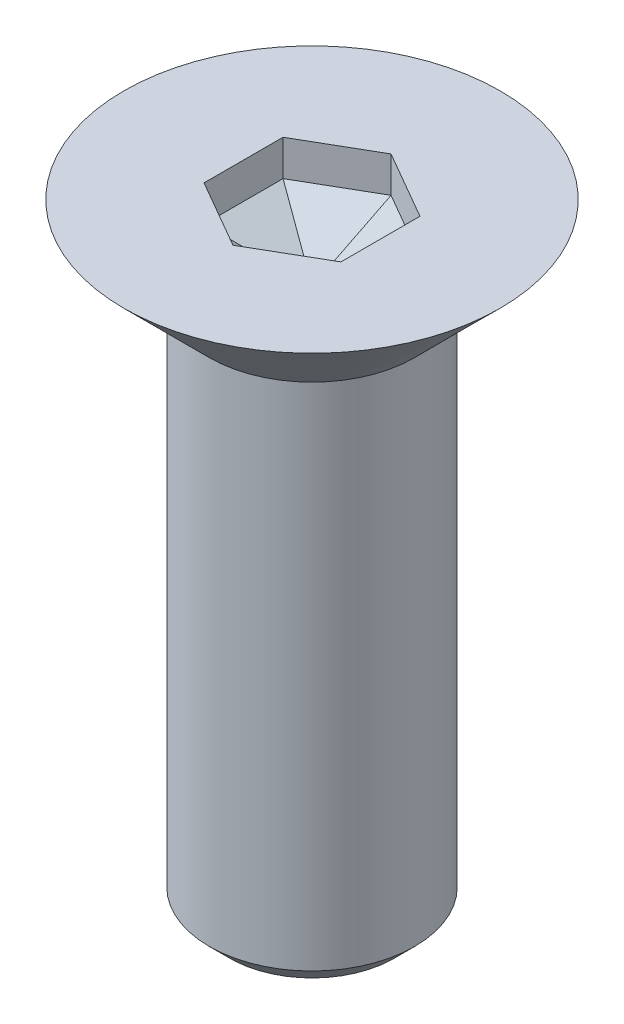
from build123d import *
from OCP.BRepFilletAPI import BRepFilletAPI_MakeChamfer

# Parameters (mm, degrees)
SKETCH_4_R          = 1.5
EXTRUDE_2_DEPTH     = 9
CUT_EXTRUDE_1_DEPTH = 1.1
CHAMFER_3_SIZE      = 0.576368876
CHAMFER_3_SIZE2     = 0.998300177
CHAMFER_4_SIZE      = 0.3


with BuildPart() as part:
    # 草图2 → 旋转1 (revolve)
    with BuildSketch(Plane.XY):
        Polygon((0, -1.86), (0, 0), (2.75, 0), (0.89, -1.86), align=None)
    revolve(axis=Axis((0, -1.86, 0), (0, 1, 0)))

    # 草图4 → 凸台-拉伸2 (add)
    with BuildSketch(Plane.XZ):
        Circle(SKETCH_4_R)
    extrude(amount=EXTRUDE_2_DEPTH)

    # 草图3 → 切除-拉伸1 (cut)
    with BuildSketch(Plane(origin=(0, 0, 0), x_dir=(1, 0, 0), z_dir=(0, 1, 0))):
        Polygon((1, 0.577350269), (0, 1.154700538), (-1, 0.577350269), (-1, -0.577350269), (0, -1.154700538), (1, -0.577350269), align=None)
    extrude(amount=-CUT_EXTRUDE_1_DEPTH, mode=Mode.SUBTRACT)

    # 倒角3: one chamfer whose edges measure the first distance from different faces: ONE call of the kernel's chamfer builder (chamfer() names one face for all edges)
    chamfer_3_edges_1 = [part.edges().sort_by_distance(p)[0] for p in [
        (-0.5, -1.1, 0.866025404),
    ]]
    chamfer_3_side_1 = [part.faces().sort_by_distance(p)[0] for p in [
        (-0.5, -0.55, 0.866025404),
    ]]
    chamfer_3_edges_2 = [part.edges().sort_by_distance(p)[0] for p in [
        (-1, -1.1, 0),
    ]]
    chamfer_3_side_2 = [part.faces().sort_by_distance(p)[0] for p in [
        (-1, -0.55, 0),
    ]]
    chamfer_3_edges_3 = [part.edges().sort_by_distance(p)[0] for p in [
        (-0.5, -1.1, -0.866025404),
    ]]
    chamfer_3_side_3 = [part.faces().sort_by_distance(p)[0] for p in [
        (-0.5, -0.55, -0.866025404),
    ]]
    chamfer_3_edges_4 = [part.edges().sort_by_distance(p)[0] for p in [
        (0.5, -1.1, -0.866025404),
    ]]
    chamfer_3_side_4 = [part.faces().sort_by_distance(p)[0] for p in [
        (0.5, -0.55, -0.866025404),
    ]]
    chamfer_3_edges_5 = [part.edges().sort_by_distance(p)[0] for p in [
        (1, -1.1, 0),
    ]]
    chamfer_3_side_5 = [part.faces().sort_by_distance(p)[0] for p in [
        (1, -0.55, 0),
    ]]
    chamfer_3_edges_6 = [part.edges().sort_by_distance(p)[0] for p in [
        (0.5, -1.1, 0.866025404),
    ]]
    chamfer_3_side_6 = [part.faces().sort_by_distance(p)[0] for p in [
        (0.5, -0.55, 0.866025404),
    ]]
    chamfer_3 = BRepFilletAPI_MakeChamfer(part.part.solid().wrapped)
    for e in chamfer_3_edges_1:
        chamfer_3.Add(CHAMFER_3_SIZE, CHAMFER_3_SIZE2, e.wrapped, chamfer_3_side_1[0].wrapped)  # the first distance lies on this face
    for e in chamfer_3_edges_2:
        chamfer_3.Add(CHAMFER_3_SIZE, CHAMFER_3_SIZE2, e.wrapped, chamfer_3_side_2[0].wrapped)  # the first distance lies on this face
    for e in chamfer_3_edges_3:
        chamfer_3.Add(CHAMFER_3_SIZE, CHAMFER_3_SIZE2, e.wrapped, chamfer_3_side_3[0].wrapped)  # the first distance lies on this face
    for e in chamfer_3_edges_4:
        chamfer_3.Add(CHAMFER_3_SIZE, CHAMFER_3_SIZE2, e.wrapped, chamfer_3_side_4[0].wrapped)  # the first distance lies on this face
    for e in chamfer_3_edges_5:
        chamfer_3.Add(CHAMFER_3_SIZE, CHAMFER_3_SIZE2, e.wrapped, chamfer_3_side_5[0].wrapped)  # the first distance lies on this face
    for e in chamfer_3_edges_6:
        chamfer_3.Add(CHAMFER_3_SIZE, CHAMFER_3_SIZE2, e.wrapped, chamfer_3_side_6[0].wrapped)  # the first distance lies on this face
    add(Compound.cast(chamfer_3.Shape()), mode=Mode.REPLACE)

    # 倒角4
    chamfer_4_edges = [part.edges().sort_by_distance(p)[0] for p in [
        (-1.5, -9, 0),
    ]]
    chamfer(chamfer_4_edges, length=CHAMFER_4_SIZE)


solid = part.part
